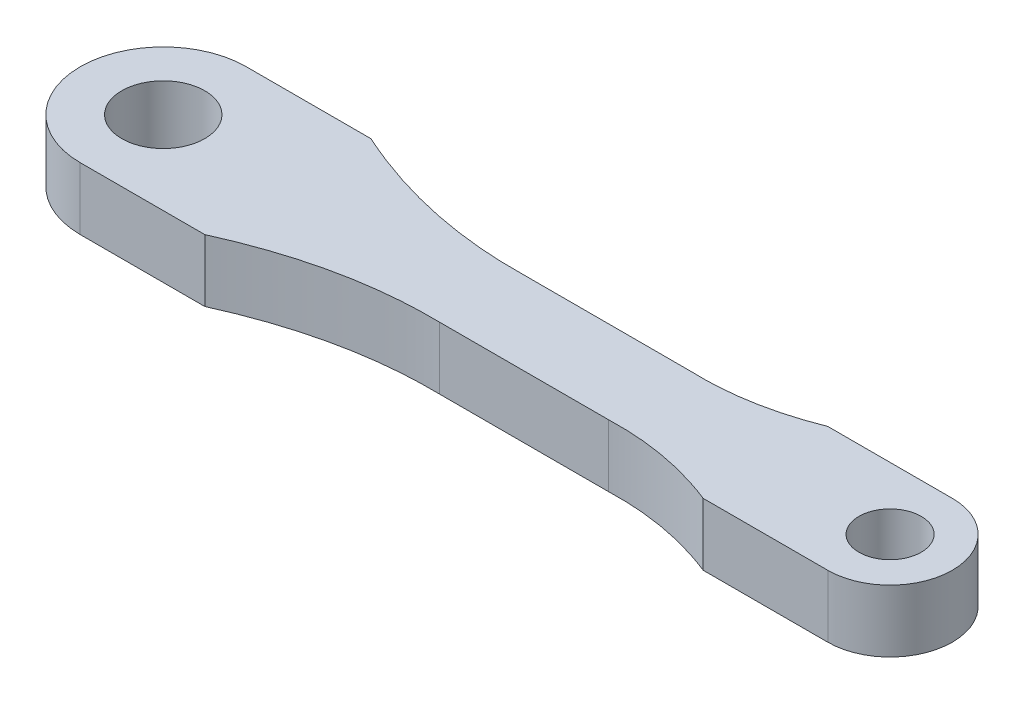
from build123d import *

# Parameters (mm, degrees)
SKETCH1_R           = 2
SKETCH1_R_2         = 1.5
BOSS_EXTRUDE1_DEPTH = 3


with BuildPart() as part:
    # Sketch1 → Boss-Extrude1 (new body)
    with BuildSketch(Plane(origin=(0, 0, 0), x_dir=(1, 0, 0), z_dir=(0, 1, 0))):
        with BuildLine():
            Line((-17.5, -4), (-11.5, -4))
            add(Edge.make_bspline(
                [(-11.5, -4), (-8.431864047, -2.610600203), (-5.332163957, -1.943933537), (-2.200899734, -2)],
                knots=[0, 0, 0, 0, 0.616300928, 0.616300928, 0.616300928, 0.616300928], degree=3))
            Line((-2.200899734, -2), (5.947351403, -2))
            add(Edge.make_bspline(
                [(11.5, -3), (9.673149322, -2.269768842), (7.822266456, -1.936435509), (5.947351403, -2)],
                knots=[0, 0, 0, 0, 0.698718256, 0.698718256, 0.698718256, 0.698718256], degree=3))
            Line((11.5, -3), (17.5, -3))
            ThreePointArc((17.5, -3), (20.5, 0), (17.5, 3))
            Line((17.5, 3), (11.5, 3))
            add(Edge.make_bspline(
                [(11.5, 3), (9.673149322, 2.269768842), (7.822266456, 1.936435509), (5.947351403, 2)],
                knots=[0, 0, 0, 0, 0.698718256, 0.698718256, 0.698718256, 0.698718256], degree=3))
            Line((5.947351403, 2), (-2.200899734, 2))
            add(Edge.make_bspline(
                [(-11.5, 4), (-8.431864047, 2.610600203), (-5.332163957, 1.943933537), (-2.200899734, 2)],
                knots=[0, 0, 0, 0, 0.616300928, 0.616300928, 0.616300928, 0.616300928], degree=3))
            Line((-11.5, 4), (-17.5, 4))
            ThreePointArc((-17.5, 4), (-21.5, 0), (-17.5, -4))
        make_face()
        with Locations(Location((-17.5, 0, 0), (0, 0, 270))):
            Circle(SKETCH1_R, mode=Mode.SUBTRACT)
        with Locations(Location((17.5, 0, 0), (0, 0, 270))):
            Circle(SKETCH1_R_2, mode=Mode.SUBTRACT)
    extrude(amount=BOSS_EXTRUDE1_DEPTH)


solid = part.part
